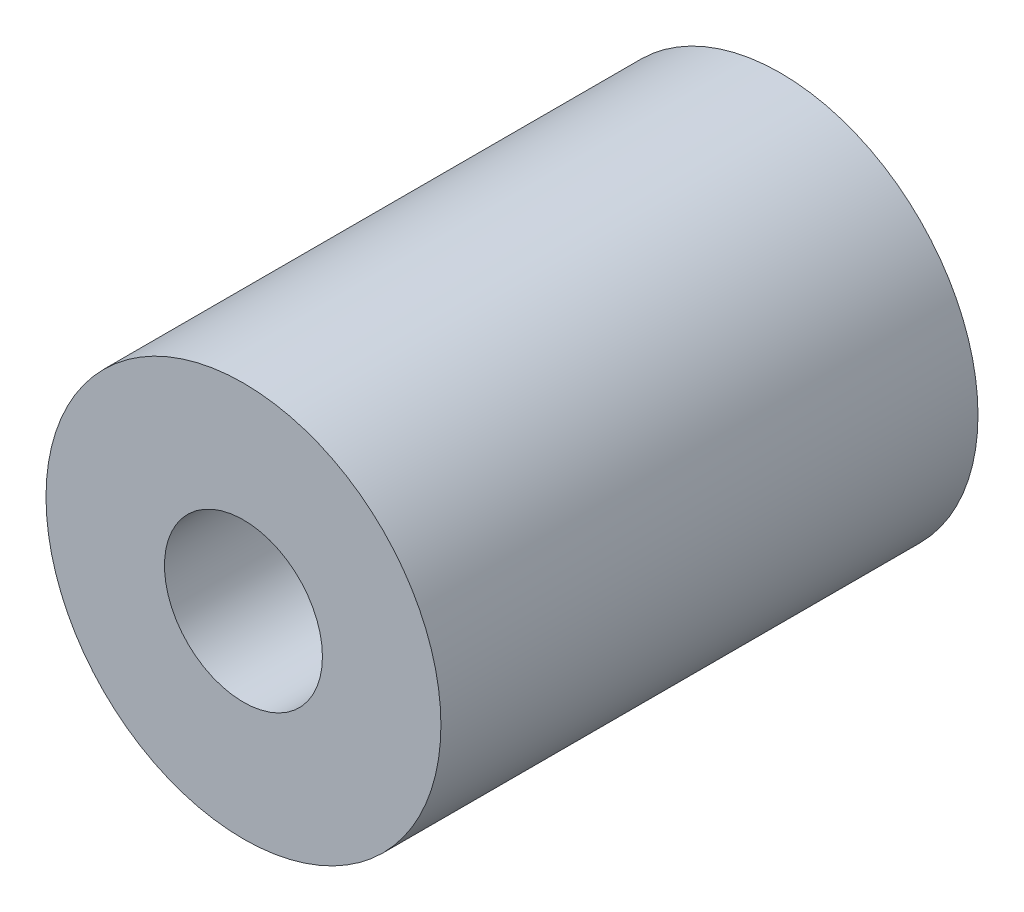
from build123d import *

# Parameters (mm, degrees)
SKETCH_1_R      = 15
SKETCH_1_R_2    = 6
EXTRUDE_1_DEPTH = 40.8


with BuildPart() as part:
    # 草图1 → 凸台-拉伸1 (new body)
    with BuildSketch(Plane.XY):
        Circle(SKETCH_1_R)
        Circle(SKETCH_1_R_2, mode=Mode.SUBTRACT)
    extrude(amount=EXTRUDE_1_DEPTH)


solid = part.part
